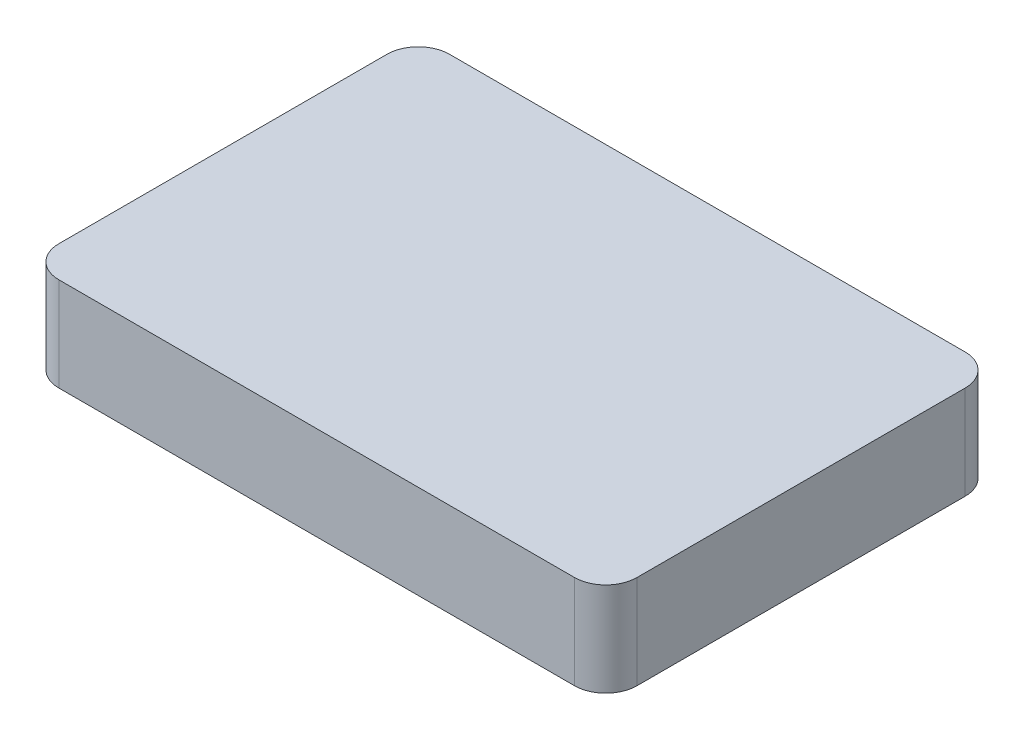
from build123d import *

# Parameters (mm, degrees)
BOSS_EXTRUDE1_DEPTH = 6


with BuildPart() as part:
    # Sketch1 → Boss-Extrude1 (new body)
    with BuildSketch(Plane(origin=(0, 0, 0), x_dir=(1, 0, 0), z_dir=(0, 1, 0))):
        with BuildLine():
            Line((16.5, -12.5), (-16.5, -12.5))
            ThreePointArc((-16.5, -12.5), (-17.914213562, -11.914213562), (-18.5, -10.5))
            Line((-18.5, -10.5), (-18.5, 10.5))
            ThreePointArc((-18.5, 10.5), (-17.914213562, 11.914213562), (-16.5, 12.5))
            Line((-16.5, 12.5), (16.5, 12.5))
            ThreePointArc((16.5, 12.5), (17.914213562, 11.914213562), (18.5, 10.5))
            Line((18.5, 10.5), (18.5, -10.5))
            ThreePointArc((18.5, -10.5), (17.914213562, -11.914213562), (16.5, -12.5))
        make_face()
    extrude(amount=BOSS_EXTRUDE1_DEPTH)


solid = part.part
